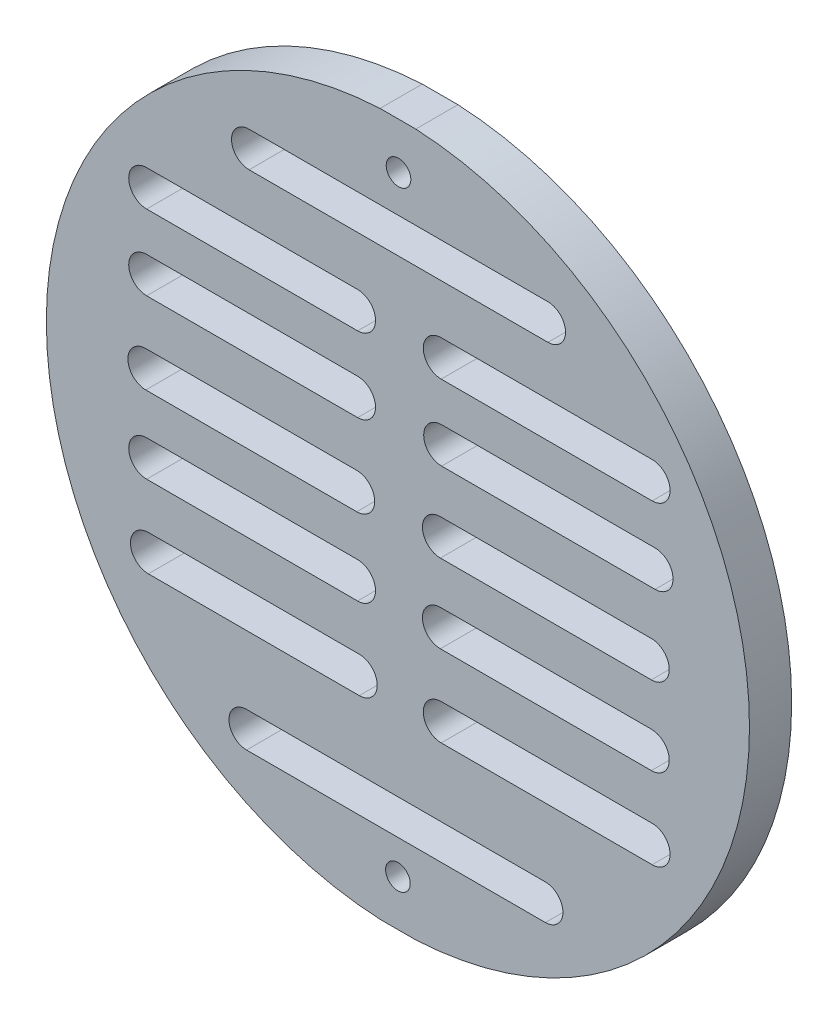
from build123d import *

# Parameters (mm, degrees)
SALIENTE_EXTRUIR1_DEPTH      = 2
SALIENTE_EXTRUIR1_DEPTH_BACK = 10
CROQUIS1_R                   = 3.5


with BuildPart() as part:
    # Croquis1 → Saliente-Extruir1 (new, two sides: drawn at the far end of the back side and taken through both)
    with BuildSketch(Plane.XY.offset(-SALIENTE_EXTRUIR1_DEPTH_BACK)):
        with BuildLine():
            ThreePointArc((-5.08027052, 99.870870886), (-100, 0), (-5.08027052, -99.870870886))
            Line((-5.08027052, -99.870870886), (5.08027052, -99.870870886))
            ThreePointArc((5.08027052, -99.870870886), (72.4845744, -68.891120429), (100, 0))
            ThreePointArc((100, 0), (72.4845744, 68.891120429), (5.08027052, 99.870870886))
            Line((5.08027052, 99.870870886), (-5.08027052, 99.870870886))
        make_face()
        with BuildLine():
            ThreePointArc((-43.051560295, -77.15), (-48.051560295, -72.15), (-43.051560295, -67.15))
            Line((-43.051560295, -67.15), (41.948439705, -67.15))
            ThreePointArc((41.948439705, -67.15), (46.948439705, -72.15), (41.948439705, -77.15))
            Line((41.948439705, -77.15), (-43.051560295, -77.15))
        make_face(mode=Mode.SUBTRACT)
        with BuildLine():
            ThreePointArc((-70.980131723, -47.721428571), (-76.080131723, -42.621428571), (-70.980131723, -37.521428571))
            Line((-70.980131723, -37.521428571), (-10.980131723, -37.521428571))
            ThreePointArc((-10.980131723, -37.521428571), (-5.880131723, -42.621428571), (-10.980131723, -47.721428571))
            Line((-10.980131723, -47.721428571), (-70.980131723, -47.721428571))
        make_face(mode=Mode.SUBTRACT)
        with BuildLine():
            ThreePointArc((-71.465846009, -24.65), (-76.565846009, -19.55), (-71.465846009, -14.45))
            Line((-71.465846009, -14.45), (-11.465846009, -14.45))
            ThreePointArc((-11.465846009, -14.45), (-6.365846009, -19.55), (-11.465846009, -24.65))
            Line((-11.465846009, -24.65), (-71.465846009, -24.65))
        make_face(mode=Mode.SUBTRACT)
        with Locations((0, -86.821428571)):
            Circle(CROQUIS1_R, mode=Mode.SUBTRACT)
        with BuildLine():
            ThreePointArc((12.319868277, -47.721428571), (7.219868277, -42.621428571), (12.319868277, -37.521428571))
            Line((12.319868277, -37.521428571), (72.319868277, -37.521428571))
            ThreePointArc((72.319868277, -37.521428571), (77.419868277, -42.621428571), (72.319868277, -47.721428571))
            Line((72.319868277, -47.721428571), (12.319868277, -47.721428571))
        make_face(mode=Mode.SUBTRACT)
        with BuildLine():
            ThreePointArc((12.077011134, -24.65), (6.977011134, -19.55), (12.077011134, -14.45))
            Line((12.077011134, -14.45), (72.077011134, -14.45))
            ThreePointArc((72.077011134, -14.45), (77.177011134, -19.55), (72.077011134, -24.65))
            Line((72.077011134, -24.65), (12.077011134, -24.65))
        make_face(mode=Mode.SUBTRACT)
        with BuildLine():
            ThreePointArc((-71.708703152, -2.792857143), (-76.808703152, 2.307142857), (-71.708703152, 7.407142857))
            Line((-71.708703152, 7.407142857), (-11.708703152, 7.407142857))
            ThreePointArc((-11.708703152, 7.407142857), (-6.608703152, 2.307142857), (-11.708703152, -2.792857143))
            Line((-11.708703152, -2.792857143), (-71.708703152, -2.792857143))
        make_face(mode=Mode.SUBTRACT)
        with BuildLine():
            ThreePointArc((-71.465846009, 20.521428571), (-76.565846009, 25.621428571), (-71.465846009, 30.721428571))
            Line((-71.465846009, 30.721428571), (-11.465846009, 30.721428571))
            ThreePointArc((-11.465846009, 30.721428571), (-6.365846009, 25.621428571), (-11.465846009, 20.521428571))
            Line((-11.465846009, 20.521428571), (-71.465846009, 20.521428571))
        make_face(mode=Mode.SUBTRACT)
        with BuildLine():
            ThreePointArc((-71.465846009, 41.892857143), (-76.565846009, 46.992857143), (-71.465846009, 52.092857143))
            Line((-71.465846009, 52.092857143), (-11.465846009, 52.092857143))
            ThreePointArc((-11.465846009, 52.092857143), (-6.365846009, 46.992857143), (-11.465846009, 41.892857143))
            Line((-11.465846009, 41.892857143), (-71.465846009, 41.892857143))
        make_face(mode=Mode.SUBTRACT)
        with BuildLine():
            ThreePointArc((12.077011134, -2.307142857), (6.977011134, 2.792857143), (12.077011134, 7.892857143))
            Line((12.077011134, 7.892857143), (72.077011134, 7.892857143))
            ThreePointArc((72.077011134, 7.892857143), (77.177011134, 2.792857143), (72.077011134, -2.307142857))
            Line((72.077011134, -2.307142857), (12.077011134, -2.307142857))
        make_face(mode=Mode.SUBTRACT)
        with BuildLine():
            ThreePointArc((12.434153991, 20.521428571), (7.334153991, 25.621428571), (12.434153991, 30.721428571))
            Line((12.434153991, 30.721428571), (73.148439705, 30.721428571))
            ThreePointArc((73.148439705, 30.721428571), (78.248439705, 25.621428571), (73.148439705, 20.521428571))
            Line((73.148439705, 20.521428571), (12.434153991, 20.521428571))
        make_face(mode=Mode.SUBTRACT)
        with BuildLine():
            ThreePointArc((12.319868277, 41.892857143), (7.219868277, 46.992857143), (12.319868277, 52.092857143))
            Line((12.319868277, 52.092857143), (72.319868277, 52.092857143))
            ThreePointArc((72.319868277, 52.092857143), (77.419868277, 46.992857143), (72.319868277, 41.892857143))
            Line((72.319868277, 41.892857143), (12.319868277, 41.892857143))
        make_face(mode=Mode.SUBTRACT)
        with BuildLine():
            ThreePointArc((-42.322988866, 66.135714286), (-47.322988866, 71.135714286), (-42.322988866, 76.135714286))
            Line((-42.322988866, 76.135714286), (42.677011134, 76.135714286))
            ThreePointArc((42.677011134, 76.135714286), (47.677011134, 71.135714286), (42.677011134, 66.135714286))
            Line((42.677011134, 66.135714286), (-42.322988866, 66.135714286))
        make_face(mode=Mode.SUBTRACT)
        with Locations((0.177011134, 86.721428571)):
            Circle(CROQUIS1_R, mode=Mode.SUBTRACT)
    extrude(amount=SALIENTE_EXTRUIR1_DEPTH + SALIENTE_EXTRUIR1_DEPTH_BACK)


solid = part.part
